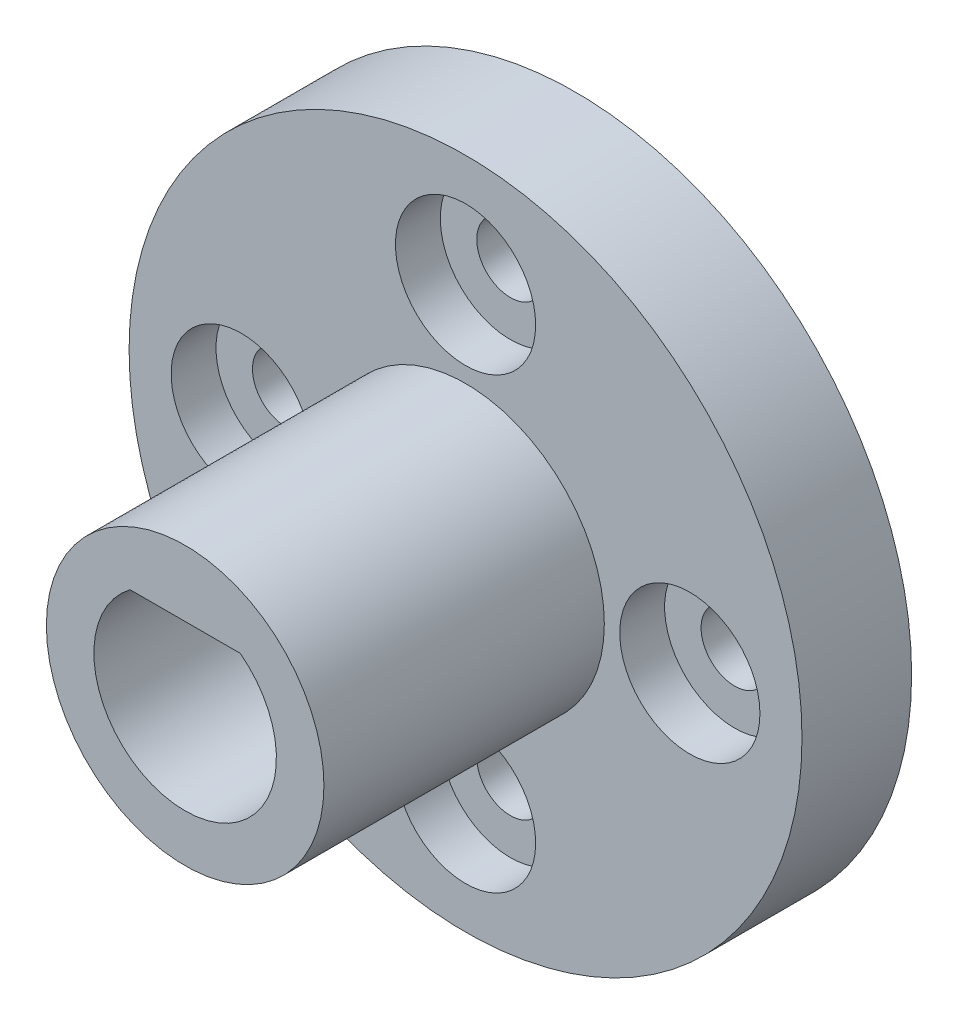
from build123d import *

# Parameters (mm, degrees)
ESQUISSE1_R                                        = 12
BOSS_EXTRU_1_DEPTH                                 = 3.91
ESQUISSE6_R                                        = 4.15
ENL_V_MAT_EXTRU_2_DEPTH                            = 1.91
ESQUISSE7_R                                        = 4.95
BOSS_EXTRU_2_DEPTH                                 = 10
CHAMBRAGE_POUR_VIS_T_TE_RONDE_BOMB_E_M_D           = 2.4
CHAMBRAGE_POUR_VIS_T_TE_RONDE_BOMB_E_M_CBORE_D     = 5
CHAMBRAGE_POUR_VIS_T_TE_RONDE_BOMB_E_M_CBORE_DEPTH = 1.6
R_P_TITION_CIRCULAIRE2_COUNT                       = 4


with BuildPart() as part:
    # Esquisse1 → Boss.-Extru.1 (new body)
    with BuildSketch(Plane.XY):
        Circle(ESQUISSE1_R)
    extrude(amount=BOSS_EXTRU_1_DEPTH)

    # Esquisse6 → Enlèv. mat.-Extru.2 (cut)
    with BuildSketch(Plane(origin=(0, 0, 0), x_dir=(-1, 0, 0), z_dir=(0, 0, -1))):
        Circle(ESQUISSE6_R)
    extrude(amount=-ENL_V_MAT_EXTRU_2_DEPTH, mode=Mode.SUBTRACT)

    # Esquisse7 → Boss.-Extru.2 (add)
    with BuildSketch(Plane.XY.offset(3.91)):
        Circle(ESQUISSE7_R)
        with BuildLine():
            Line((1.964942747, 2.595), (-1.964942747, 2.595))
            ThreePointArc((-1.964942747, 2.595), (0, -3.255), (1.964942747, 2.595))
        make_face(mode=Mode.SUBTRACT)
    extrude(amount=BOSS_EXTRU_2_DEPTH)

    # Chambrage pour vis à tête ronde bombée M21 (through all)
    with Locations(Plane.XY.offset(3.91)):
        with Locations((0, 8)):
            chambrage_pour_vis_t_te_ronde_bomb_e_m = CounterBoreHole(CHAMBRAGE_POUR_VIS_T_TE_RONDE_BOMB_E_M_D / 2, CHAMBRAGE_POUR_VIS_T_TE_RONDE_BOMB_E_M_CBORE_D / 2, CHAMBRAGE_POUR_VIS_T_TE_RONDE_BOMB_E_M_CBORE_DEPTH)

    # Répétition circulaire2: Chambrage pour vis à tête ronde bombée M21 ×4 about axis
    r_p_tition_circulaire2_axis = Axis((0, 0, 0), (0, 0, 1))
    for i in range(1, R_P_TITION_CIRCULAIRE2_COUNT):
        add(chambrage_pour_vis_t_te_ronde_bomb_e_m.rotate(r_p_tition_circulaire2_axis, i * 360 / R_P_TITION_CIRCULAIRE2_COUNT), mode=Mode.SUBTRACT)


solid = part.part
